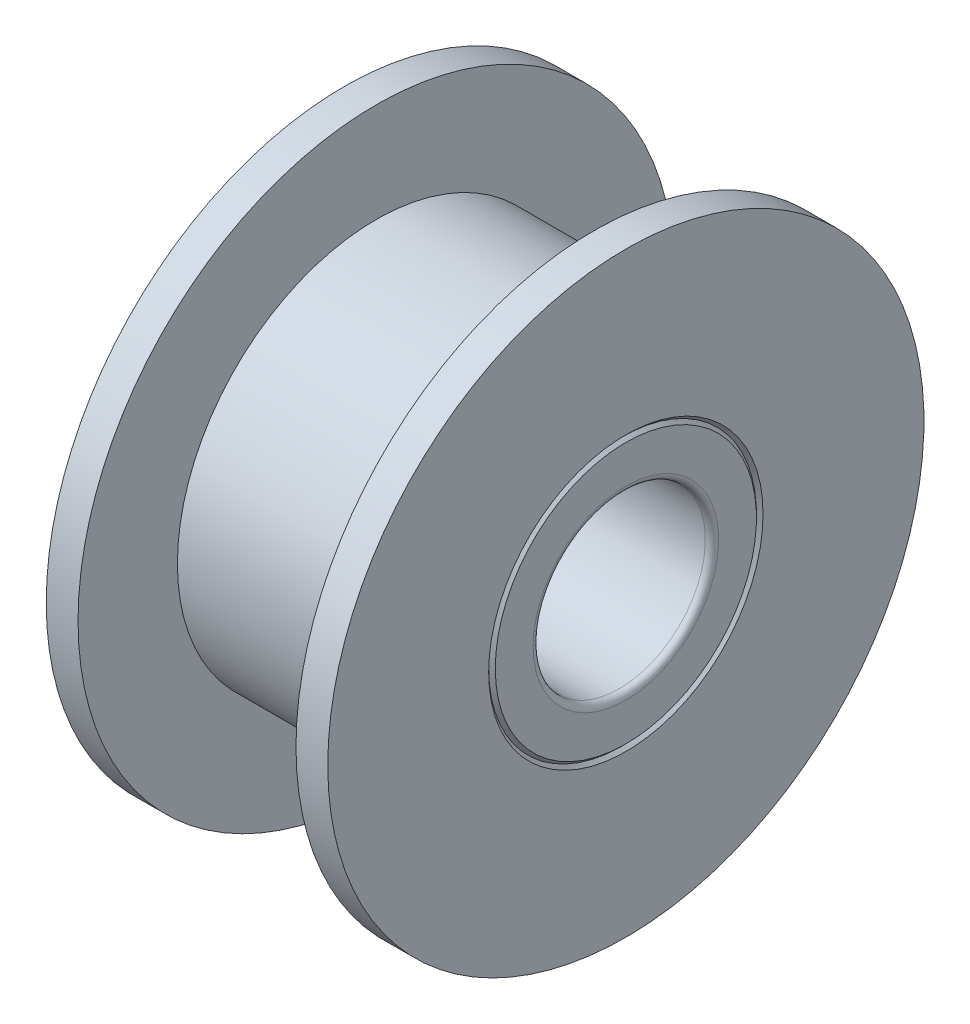
from build123d import *

# Parameters (mm, degrees)
FILLET1_R = 0.2


with BuildPart() as part:
    # Sketch 1 → Body (revolve)
    with BuildSketch(Plane.XY):
        Polygon((6.46, 7.5), (5.5, 7.5), (5.5, 2.642391609), (5.6034939, 2.5), (5.5, 2.357608391), (5.5, 1.1), (14, 1.1), (14, 2.442391609), (13.9, 2.542391609), (14, 2.642391609), (14, 7.5), (13.04, 7.5), (13.04, 4.5), (6.46, 4.5), align=None)
    revolve(axis=Axis((1, -1.5, 0), (1, 0, 0)))

    # Fillet1
    fillet1_edges = [part.edges().sort_by_distance(p)[0] for p in [
        (14, -4.1, 0),
        (5.5, -4.1, 0),
    ]]
    fillet(fillet1_edges, radius=FILLET1_R)


solid = part.part
